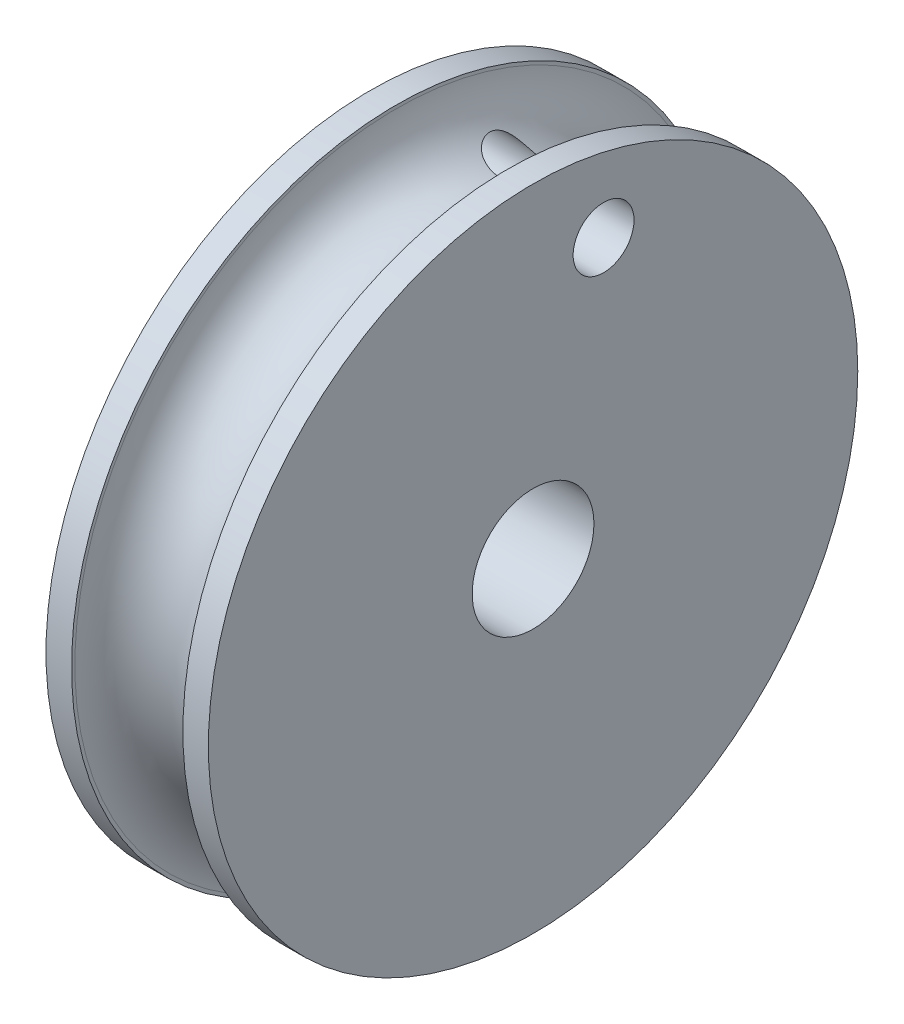
from build123d import *

# Parameters (mm, degrees)
SKETCH3_R          = 4.7625
CUT_EXTRUDE1_DEPTH = 48.519048812
CUT_EXTRUDE2_REACH = 49.519
SKETCH4_R          = 2.38125


with BuildPart() as part:
    # Sketch2 → Revolve1 (revolve)
    with BuildSketch(Plane(origin=(0, 0, 0), x_dir=(1, 0, 0), z_dir=(0, 1, 0))):
        with BuildLine():
            Line((6.35, -12.7), (6.35, 12.7))
            Line((6.35, 12.7), (4.357673642, 12.7))
            ThreePointArc((4.357673642, 12.7), (0.129304347, 8.344245191), (-4.35, 12.441505181))
            Line((-4.35, 12.441505181), (-4.35, 12.7))
            Line((-4.35, 12.7), (-6.35, 12.7))
            Line((-6.35, 12.7), (-6.35, -12.7))
            Line((-6.35, -12.7), (6.35, -12.7))
        make_face()
    revolve(axis=Axis((6.35, 0, 12.7), (-1, 0, 0)))

    # Sketch3 → Cut-Extrude1 (cut, through all)
    with BuildSketch(Plane(origin=(6.35, 0, 0), x_dir=(0, 0, -1), z_dir=(1, 0, 0))):
        with Locations((-12.7, 0)):
            Circle(SKETCH3_R)
    extrude(amount=-CUT_EXTRUDE1_DEPTH, mode=Mode.SUBTRACT)

    # Sketch4 → Cut-Extrude2 (cut, up to next)
    with BuildSketch(Plane(origin=(6.35, 0, 0), x_dir=(0, 0, -1), z_dir=(1, 0, 0)), mode=Mode.PRIVATE) as cut_extrude2_sk1:
        with Locations((-7.184338108, 19)):
            Circle(SKETCH4_R)
    cut_extrude2_tool1 = extrude(cut_extrude2_sk1.sketch, amount=-CUT_EXTRUDE2_REACH, mode=Mode.PRIVATE) & part.part
    add(cut_extrude2_tool1.solids().sort_by_distance((6.35, 19, 7.184338))[0], mode=Mode.SUBTRACT)


solid = part.part
